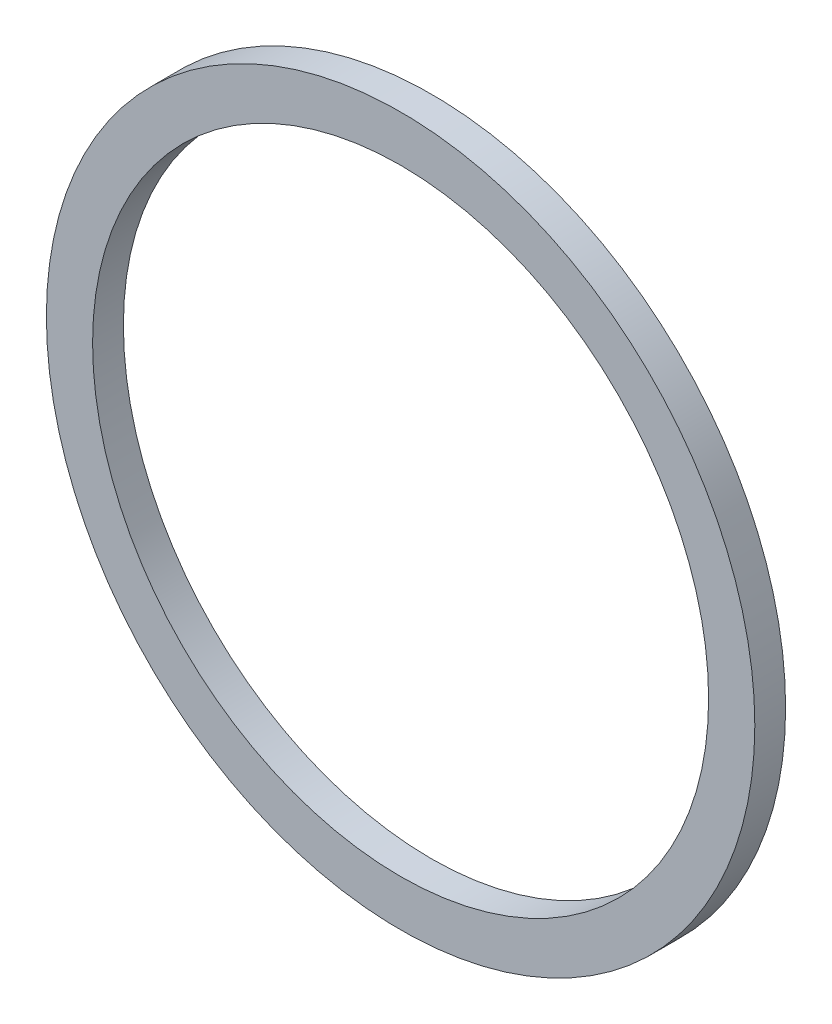
from build123d import *

# Parameters (mm, degrees)
SKETCH_1_R      = 11.5
SKETCH_1_R_2    = 10
EXTRUDE_1_DEPTH = 1


with BuildPart() as part:
    # 草图1 → 凸台-拉伸1 (new body)
    with BuildSketch(Plane.XY):
        Circle(SKETCH_1_R)
        Circle(SKETCH_1_R_2, mode=Mode.SUBTRACT)
    extrude(amount=EXTRUDE_1_DEPTH)


solid = part.part
